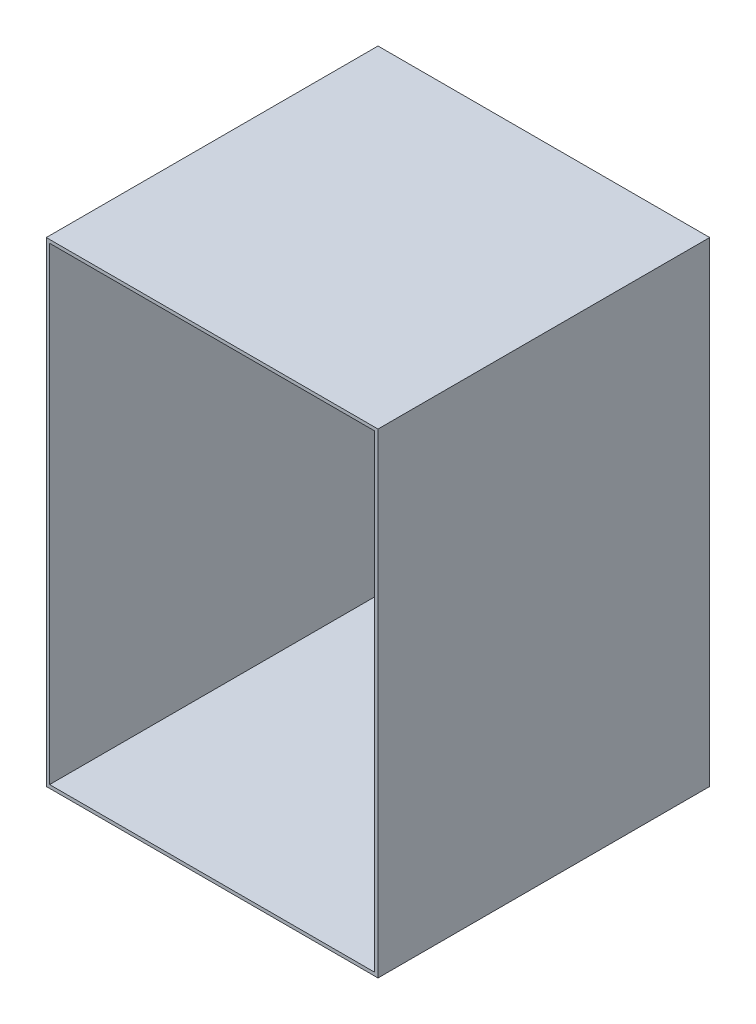
from build123d import *

# Parameters (mm, degrees)
ESQUISSE1_W             = 300
ESQUISSE1_H             = 430
BOSS_EXTRU_1_DEPTH      = 300
ESQUISSE2_W             = 294
ESQUISSE2_H             = 424
ENL_V_MAT_EXTRU_1_DEPTH = 297


with BuildPart() as part:
    # Esquisse1 → Boss.-Extru.1 (new body)
    with BuildSketch(Plane.XY):
        with Locations((150, 215)):
            Rectangle(ESQUISSE1_W, ESQUISSE1_H)
    extrude(amount=-BOSS_EXTRU_1_DEPTH)

    # Esquisse2 → Enlèv. mat.-Extru.1 (cut)
    with BuildSketch(Plane.XY):
        with Locations((150, 215)):
            Rectangle(ESQUISSE2_W, ESQUISSE2_H)
    extrude(amount=-ENL_V_MAT_EXTRU_1_DEPTH, mode=Mode.SUBTRACT)


solid = part.part
